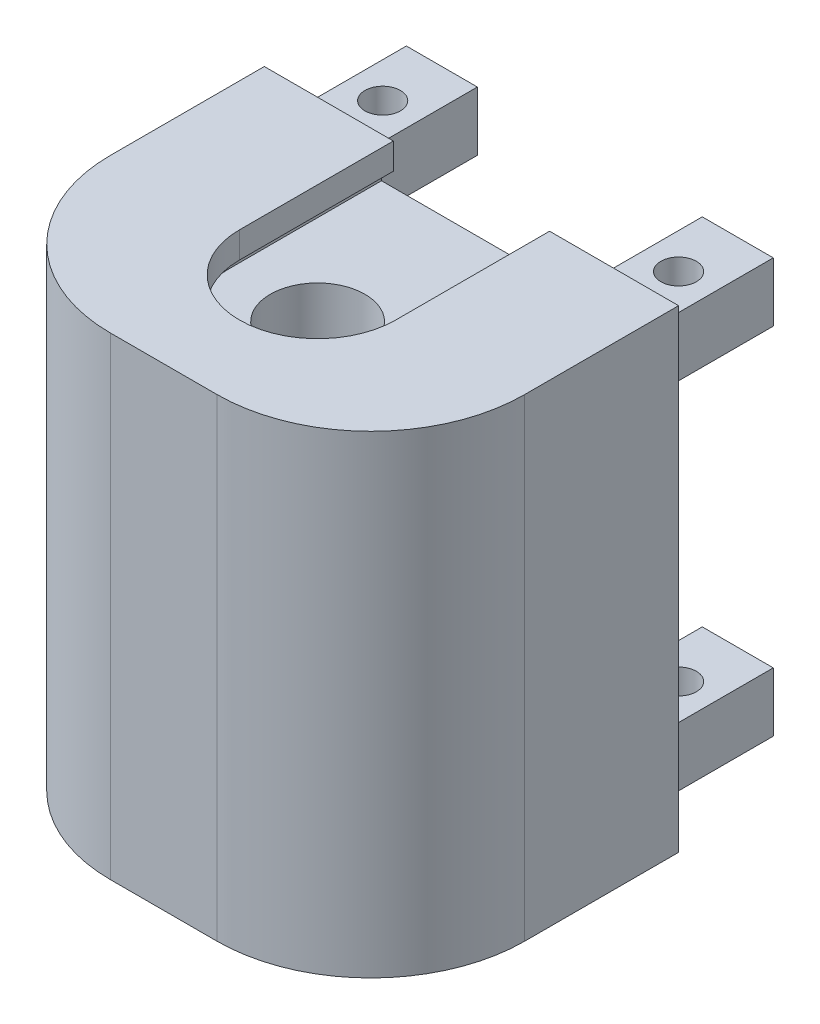
from build123d import *

# Parameters (mm, degrees)
SKETCH10_W           = 35
SKETCH10_H           = 26
BOSS_EXTRUDE4_DEPTH  = 2.5
SKETCH1_R            = 1.5
BOSS_EXTRUDE5_DEPTH  = 5
SKETCH11_W           = 35
SKETCH11_H           = 26
BOSS_EXTRUDE6_DEPTH  = 2.5
CUT_EXTRUDE1_START   = -13
CUT_EXTRUDE1_DEPTH   = 56.676105727
SKETCH4_R            = 7.6
CUT_EXTRUDE2_DEPTH   = 1.2
SKETCH5_R            = 6.6
CUT_EXTRUDE3_DEPTH   = 50.27874954
SKETCH12_W           = 35
SKETCH12_H           = 26
BOSS_EXTRUDE7_DEPTH  = 15
SKETCH13_W           = 35
SKETCH13_H           = 26
BOSS_EXTRUDE8_DEPTH  = 7.5
SKETCH14_R           = 1.5
BOSS_EXTRUDE9_DEPTH  = 5
SKETCH15_W           = 35
SKETCH15_H           = 26
BOSS_EXTRUDE10_DEPTH = 2.5
SKETCH8_R            = 4
CUT_EXTRUDE6_DEPTH   = 62.021677757
FILLET1_R            = 13


with BuildPart() as part:
    # Sketch10 → Boss-Extrude4 (new body)
    with BuildSketch(Plane(origin=(0, 0, 0), x_dir=(1, 0, 0), z_dir=(0, 1, 0))):
        with Locations((15.5, -23)):
            Rectangle(SKETCH10_W, SKETCH10_H)
    extrude(amount=BOSS_EXTRUDE4_DEPTH)

    # Sketch1 → Boss-Extrude5 (add)
    with BuildSketch(Plane(origin=(0, 0, 0), x_dir=(1, 0, 0), z_dir=(0, 1, 0))):
        Polygon((0, 0), (6, 0), (6, -10), (25, -10), (25, 0), (31, 0), (31, -10), (33, -10), (33, -36), (-2, -36), (-2, -10), (0, -10), align=None)
        with Locations(Location((3, -5, 0), (0, 0, 270))):
            Circle(SKETCH1_R, mode=Mode.SUBTRACT)
        with Locations(Location((28, -5, 0), (0, 0, 90))):
            Circle(SKETCH1_R, mode=Mode.SUBTRACT)
    extrude(amount=-BOSS_EXTRUDE5_DEPTH)

    # Sketch11 → Boss-Extrude6 (add)
    with BuildSketch(Plane.XZ.offset(5)):
        with Locations((15.5, 23)):
            Rectangle(SKETCH11_W, SKETCH11_H)
    extrude(amount=BOSS_EXTRUDE6_DEPTH)

    # Sketch3 → Cut-Extrude1 (cut)
    with BuildSketch(Plane(origin=(0, 0, 10), x_dir=(-1, 0, 0), z_dir=(0, 0, -1)).offset(CUT_EXTRUDE1_START)):
        Polygon((-22.1, 2.5), (-22.1, 0.2875), (-23.1, 0.2875), (-23.1, -0.9125), (-15.5, -0.9125), (-7.9, -0.9125), (-7.9, 0.2875), (-8.9, 0.2875), (-8.9, 2.5), align=None)
    cut_extrude1 = extrude(amount=CUT_EXTRUDE1_DEPTH, mode=Mode.SUBTRACT)

    # Sketch4 → Cut-Extrude2 (cut)
    with BuildSketch(Plane(origin=(0, -0.9125, 0), x_dir=(1, 0, 0), z_dir=(0, 1, 0))):
        with Locations((15.5, -23)):
            Circle(SKETCH4_R)
    cut_extrude2 = extrude(amount=CUT_EXTRUDE2_DEPTH, mode=Mode.SUBTRACT)

    # Sketch5 → Cut-Extrude3 (cut, through all)
    with BuildSketch(Plane(origin=(0, -0.9125, 0), x_dir=(1, 0, 0), z_dir=(0, 1, 0))):
        with Locations((15.5, -23)):
            Circle(SKETCH5_R)
    cut_extrude3 = extrude(amount=CUT_EXTRUDE3_DEPTH, mode=Mode.SUBTRACT)

    # Sketch12 → Boss-Extrude7 (add)
    with BuildSketch(Plane.XZ.offset(7.5)):
        with Locations((15.5, 23)):
            Rectangle(SKETCH12_W, SKETCH12_H)
    extrude(amount=BOSS_EXTRUDE7_DEPTH)

    # Sketch13 → Boss-Extrude8 (add)
    with BuildSketch(Plane.XZ.offset(22.5)):
        with Locations((15.5, 23)):
            Rectangle(SKETCH13_W, SKETCH13_H)
    extrude(amount=BOSS_EXTRUDE8_DEPTH)

    # Sketch14 → Boss-Extrude9 (add)
    with BuildSketch(Plane.XZ.offset(30)):
        Polygon((0, 0), (6, 0), (6, 10), (25, 10), (25, 0), (31, 0), (31, 10), (33, 10), (33, 36), (-2, 36), (-2, 10), (0, 10), align=None)
        with Locations(Location((3, 5, 0), (0, 0, 90))):
            Circle(SKETCH14_R, mode=Mode.SUBTRACT)
        with Locations(Location((28, 5, 0), (0, 0, 270))):
            Circle(SKETCH14_R, mode=Mode.SUBTRACT)
    extrude(amount=BOSS_EXTRUDE9_DEPTH)

    # Sketch15 → Boss-Extrude10 (add)
    with BuildSketch(Plane.XZ.offset(35)):
        with Locations((15.5, 23)):
            Rectangle(SKETCH15_W, SKETCH15_H)
    extrude(amount=BOSS_EXTRUDE10_DEPTH)

    # Mirror8: Cut-Extrude1, Cut-Extrude2, Cut-Extrude3 across plane
    add(cut_extrude1.mirror(Plane.ZX.offset(-17.5)), mode=Mode.SUBTRACT)
    add(cut_extrude2.mirror(Plane.ZX.offset(-17.5)), mode=Mode.SUBTRACT)
    add(cut_extrude3.mirror(Plane.ZX.offset(-17.5)), mode=Mode.SUBTRACT)

    # Sketch8 → Cut-Extrude6 (cut, through all)
    with BuildSketch(Plane(origin=(0, -0.9125, 0), x_dir=(1, 0, 0), z_dir=(0, 1, 0))):
        with Locations(Location((15.5, -23, 0), (0, 0, 270))):
            Circle(SKETCH8_R)
    extrude(amount=-CUT_EXTRUDE6_DEPTH, mode=Mode.SUBTRACT)

    # Fillet1
    fillet1_edges = [part.edges().sort_by_distance(p)[0] for p in [
        (33, -17.5, 36),
        (-2, -17.5, 36),
    ]]
    fillet(fillet1_edges, radius=FILLET1_R)


solid = part.part
